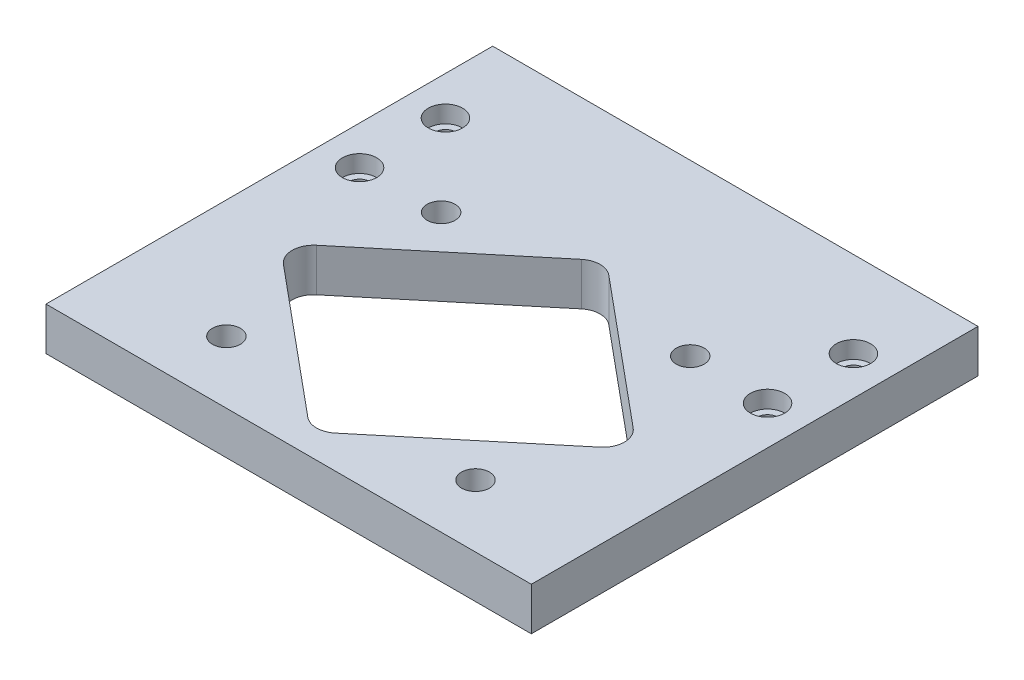
from build123d import *

# Parameters (mm, degrees)
SKETCH2_W                      = 113
SKETCH2_H                      = 104
TOP_FACE_DEPTH                 = 10
SKETCH3_R                      = 3.25
CUT_EXTRUDE1_DEPTH             = 10
CUT_EXTRUDE2_DEPTH             = 10
FILLET1_R                      = 5
CBORE_FOR_M4_SHCS1_D           = 4.8
CBORE_FOR_M4_SHCS1_CBORE_D     = 8
CBORE_FOR_M4_SHCS1_CBORE_DEPTH = 4


with BuildPart() as part:
    # Sketch2 → Top Face (new body)
    with BuildSketch(Plane(origin=(0, 0, 0), x_dir=(1, 0, 0), z_dir=(0, 1, 0))):
        with Locations((0, 12.5)):
            Rectangle(SKETCH2_W, SKETCH2_H)
    extrude(amount=TOP_FACE_DEPTH)

    # Sketch3 → Cut-Extrude1 (cut)
    with BuildSketch(Plane.XZ):
        with Locations(Location((-29, 25, 0), (0, 0, 270))):
            Circle(SKETCH3_R)
        with Locations(Location((-29, -25, 0), (0, 0, 270))):
            Circle(SKETCH3_R)
        with Locations(Location((29, -25, 0), (0, 0, 270))):
            Circle(SKETCH3_R)
        with Locations(Location((29, 25, 0), (0, 0, 270))):
            Circle(SKETCH3_R)
    extrude(amount=-CUT_EXTRUDE1_DEPTH, mode=Mode.SUBTRACT)

    # Sketch4 → Cut-Extrude2 (cut)
    with BuildSketch(Plane(origin=(0, 10, 0), x_dir=(1, 0, 0), z_dir=(0, 1, 0))):
        Polygon((0, 34.5), (-41.5, 0), (0, -34.5), (41.5, 0), align=None)
    extrude(amount=-CUT_EXTRUDE2_DEPTH, mode=Mode.SUBTRACT)

    # Fillet1
    fillet1_edges = [part.edges().sort_by_distance(p)[0] for p in [
        (0, 5, -34.5),
        (41.5, 5, 0),
        (0, 5, 34.5),
        (-41.5, 5, 0),
    ]]
    fillet(fillet1_edges, radius=FILLET1_R)

    # CBORE for M4 SHCS1 (through all)
    with Locations(Plane(origin=(0, 10, 0), x_dir=(1, 0, 0), z_dir=(0, 1, 0))):
        with Locations((47.5, 44.5), (47.5, 24.5), (-47.5, 24.5), (-47.5, 44.5)):
            CounterBoreHole(CBORE_FOR_M4_SHCS1_D / 2, CBORE_FOR_M4_SHCS1_CBORE_D / 2, CBORE_FOR_M4_SHCS1_CBORE_DEPTH)


solid = part.part
